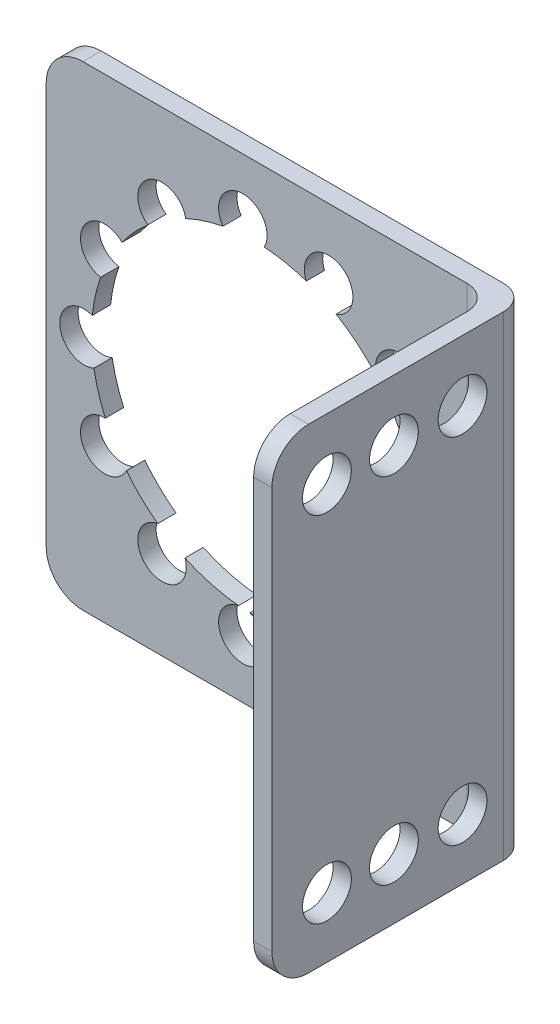
from build123d import *

# Parameters (mm, degrees)
SKETCH1_W               = 38
SKETCH1_H               = 38.950729927
SKETCH1_R               = 13.294995111
BOSS_EXTRUDE1_DEPTH     = 1.5
SKETCH4_W               = 19.5
SKETCH4_H               = 38.950729927
BOSS_EXTRUDE2_DEPTH     = 1.5
CUT_EXTRUDE2_DEPTH      = 35.383862494
CUT_EXTRUDE2_DEPTH_BACK = 35.383862494
SKETCH5_R               = 2
FILLET2_R               = 3
FILLET6_R               = 2
SKETCH6_R               = 1.98665291
CUT_EXTRUDE5_DEPTH      = 1.5


with BuildPart() as part:
    # Sketch1 → Boss-Extrude1 (new body)
    with BuildSketch(Plane.XY):
        with Locations((0, 0.024635036)):
            Rectangle(SKETCH1_W, SKETCH1_H)
        with Locations((-2, 0.5)):
            Circle(SKETCH1_R, mode=Mode.SUBTRACT)
    extrude(amount=BOSS_EXTRUDE1_DEPTH)

    # Sketch4 → Boss-Extrude2 (add)
    with BuildSketch(Plane(origin=(19, 0, 0), x_dir=(0, 0, -1), z_dir=(1, 0, 0))):
        with Locations((-11.25, 0.024635036)):
            Rectangle(SKETCH4_W, SKETCH4_H)
    extrude(amount=-BOSS_EXTRUDE2_DEPTH)

    # Sketch5 → Cut-Extrude2 (cut, two sides: drawn at the far end of the back side and taken through both)
    with BuildSketch(Plane(origin=(0, 0, 0), x_dir=(0, 0, -1), z_dir=(1, 0, 0)).offset(-CUT_EXTRUDE2_DEPTH_BACK)):
        with Locations((-5.375668666, 14.5)):
            Circle(SKETCH5_R)
        with Locations((-11, 14.5)):
            Circle(SKETCH5_R)
        with Locations((-16.492234483, 14.5)):
            Circle(SKETCH5_R)
        with Locations(Location((-16.492234483, -14.5, 0), (0, 0, 270))):
            Circle(SKETCH5_R)
        with Locations(Location((-11, -14.5, 0), (0, 0, 270))):
            Circle(SKETCH5_R)
        with Locations(Location((-5.375668666, -14.5, 0), (0, 0, 270))):
            Circle(SKETCH5_R)
    extrude(amount=CUT_EXTRUDE2_DEPTH + CUT_EXTRUDE2_DEPTH_BACK, mode=Mode.SUBTRACT)

    # Fillet2
    fillet2_edges = [part.edges().sort_by_distance(p)[0] for p in [
        (18.25, -19.450729927, 21),
        (18.25, 19.5, 21),
        (-19, -19.450729927, 0.75),
        (-19, 19.5, 0.75),
    ]]
    fillet(fillet2_edges, radius=FILLET2_R)

    # Fillet6
    fillet6_edges = [part.edges().sort_by_distance(p)[0] for p in [
        (19, 0.024635036, 0),
        (17.5, 0.024635036, 1.5),
    ]]
    fillet(fillet6_edges, radius=FILLET6_R)

    # Sketch6 → Cut-Extrude5 (cut)
    with BuildSketch(Plane.XY):
        with Locations((-15.899992969, 0)):
            Circle(SKETCH6_R)
        with Locations((-14.204742149, 6.877902946)):
            Circle(SKETCH6_R)
        with Locations((-9.507351221, 12.180161215)):
            Circle(SKETCH6_R)
        with Locations((-2.883935837, 14.692091337)):
            Circle(SKETCH6_R)
        with Locations((4.148159359, 13.838240392)):
            Circle(SKETCH6_R)
        with Locations((9.977966104, 9.814215342)):
            Circle(SKETCH6_R)
        with Locations((13.269945929, 3.541871831)):
            Circle(SKETCH6_R)
        with Locations((13.269945929, -3.541871831)):
            Circle(SKETCH6_R)
        with Locations((9.977966104, -9.814215342)):
            Circle(SKETCH6_R)
        with Locations((4.148159359, -13.838240392)):
            Circle(SKETCH6_R)
        with Locations((-2.883935837, -14.692091337)):
            Circle(SKETCH6_R)
        with Locations((-9.507351221, -12.180161215)):
            Circle(SKETCH6_R)
        with Locations((-14.204742149, -6.877902946)):
            Circle(SKETCH6_R)
    extrude(amount=CUT_EXTRUDE5_DEPTH, mode=Mode.SUBTRACT)


solid = part.part
